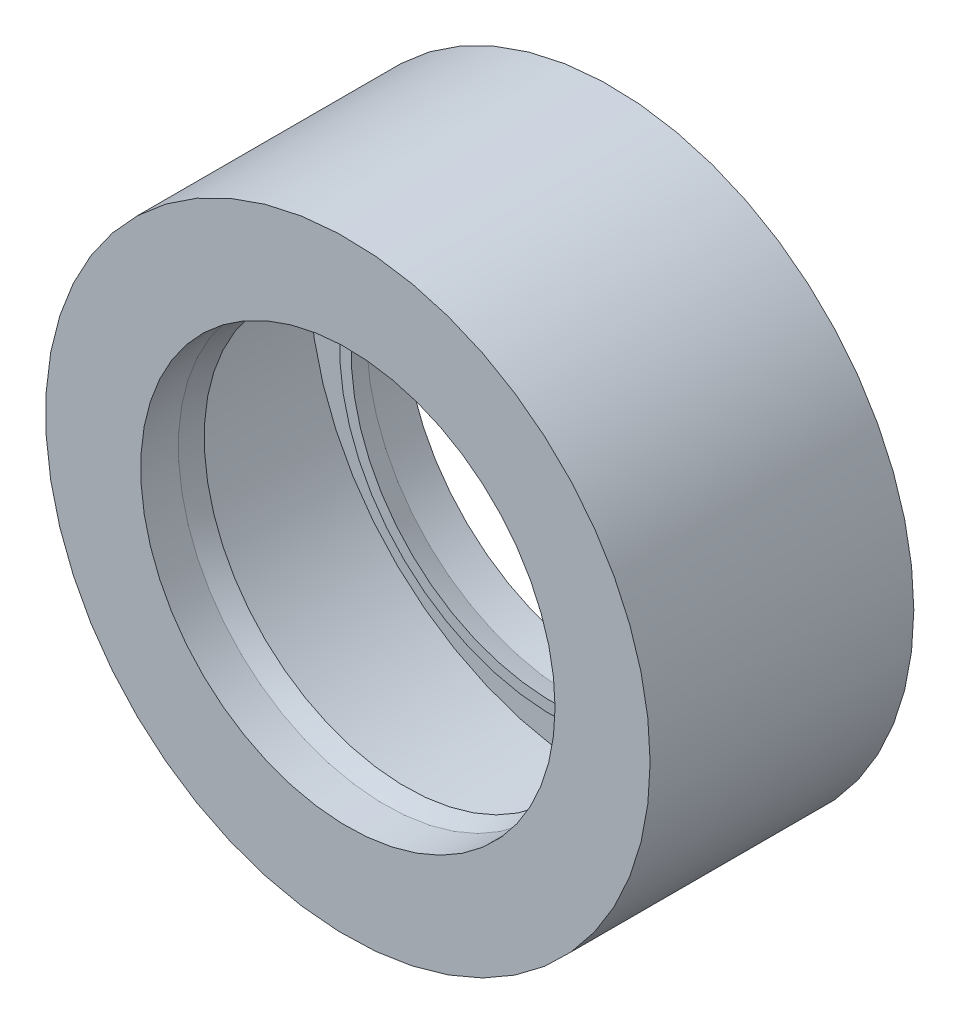
from build123d import *


with BuildPart() as part:
    # 草圖4 → 旋轉1 (revolve)
    with BuildSketch(Plane(origin=(0, 0, 0), x_dir=(0, 0, -1), z_dir=(1, 0, 0)), mode=Mode.PRIVATE) as revolve_1_sk:
        with BuildLine():
            Line((0, 55), (10, 55))
            ThreePointArc((10, 55), (12.745508857, 54.295513936), (15.502645054, 53.638003865))
            Line((15.502645054, 53.638003865), (15.502645054, 56.7174692))
            ThreePointArc((15.502645054, 56.7174692), (12.942937744, 57.338097036), (10.393591772, 58))
            Line((10.393591772, 58), (3, 58))
            Line((3, 58), (3, 77.239932534))
            Line((3, 77.239932534), (67, 77.239932534))
            Line((67, 77.239932534), (67, 58))
            Line((67, 58), (59.606408228, 58))
            ThreePointArc((59.606408228, 58), (57.057062256, 57.338097036), (54.497354946, 56.7174692))
            Line((54.497354946, 56.7174692), (54.497354946, 53.638003865))
            ThreePointArc((54.497354946, 53.638003865), (57.254491143, 54.295513936), (60, 55))
            Line((60, 55), (70, 55))
            Line((70, 55), (70, 80.239932534))
            Line((70, 80.239932534), (0, 80.239932534))
            Line((0, 80.239932534), (0, 55))
        make_face()
    revolve(revolve_1_sk.sketch.rotate(Axis((0, 0, 0), (0, 0, -1)), 90), axis=Axis((0, 0, 0), (0, 0, -1)))


solid = part.part
